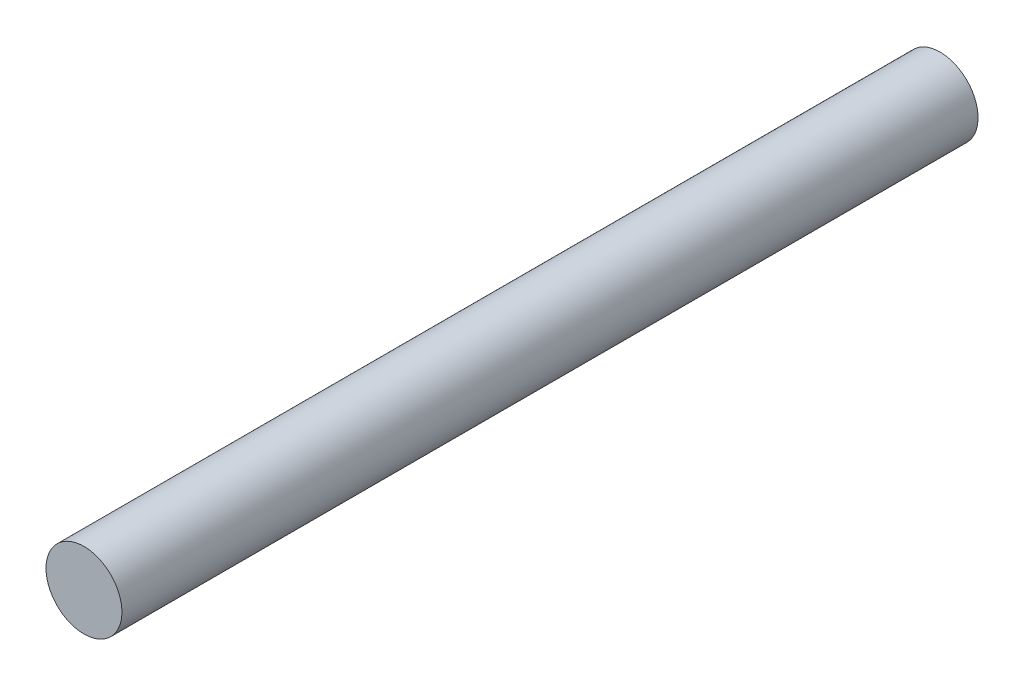
from build123d import *

# Parameters (mm, degrees)
SKETCH1_R           = 3.3782
BOSS_EXTRUDE1_DEPTH = 76.2


with BuildPart() as part:
    # Sketch1 → Boss-Extrude1 (new body)
    with BuildSketch(Plane.XY):
        with Locations(Location((0, 0, 0), (0, 0, 180))):
            Circle(SKETCH1_R)
    extrude(amount=BOSS_EXTRUDE1_DEPTH)


solid = part.part
